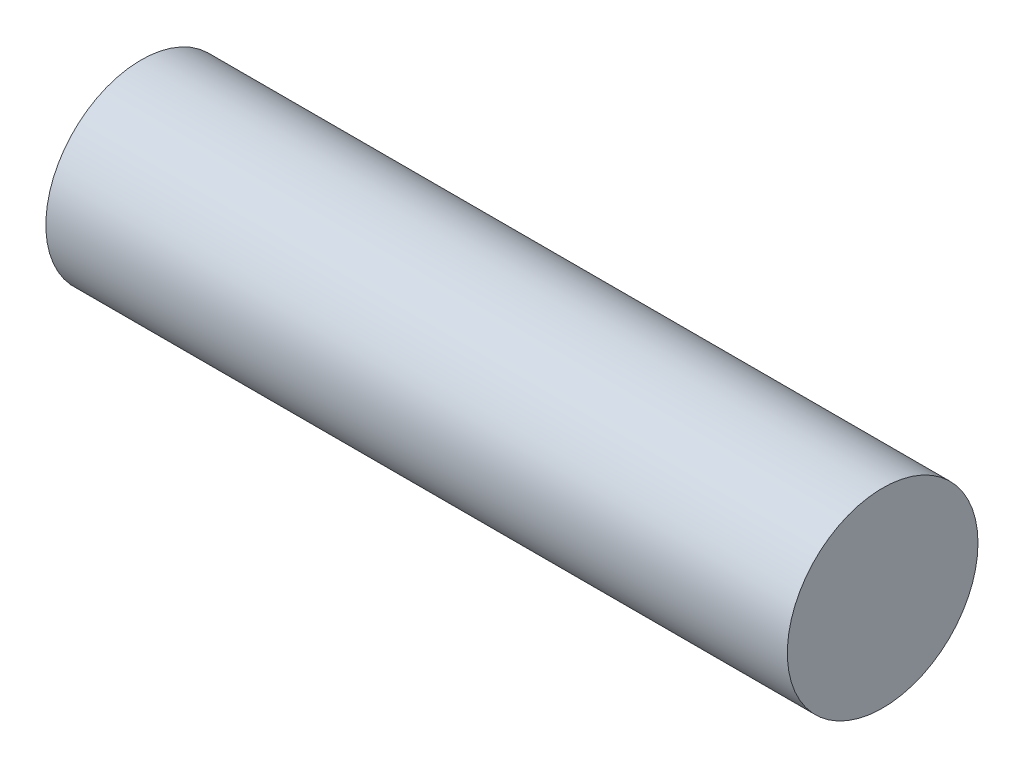
from build123d import *

# Parameters (mm, degrees)
SKETCH1_R           = 9
BOSS_EXTRUDE1_DEPTH = 70


with BuildPart() as part:
    # Sketch1 → Boss-Extrude1 (new body)
    with BuildSketch(Plane(origin=(0, 0, 0), x_dir=(0, 0, -1), z_dir=(1, 0, 0))):
        Circle(SKETCH1_R)
    extrude(amount=BOSS_EXTRUDE1_DEPTH)


solid = part.part
